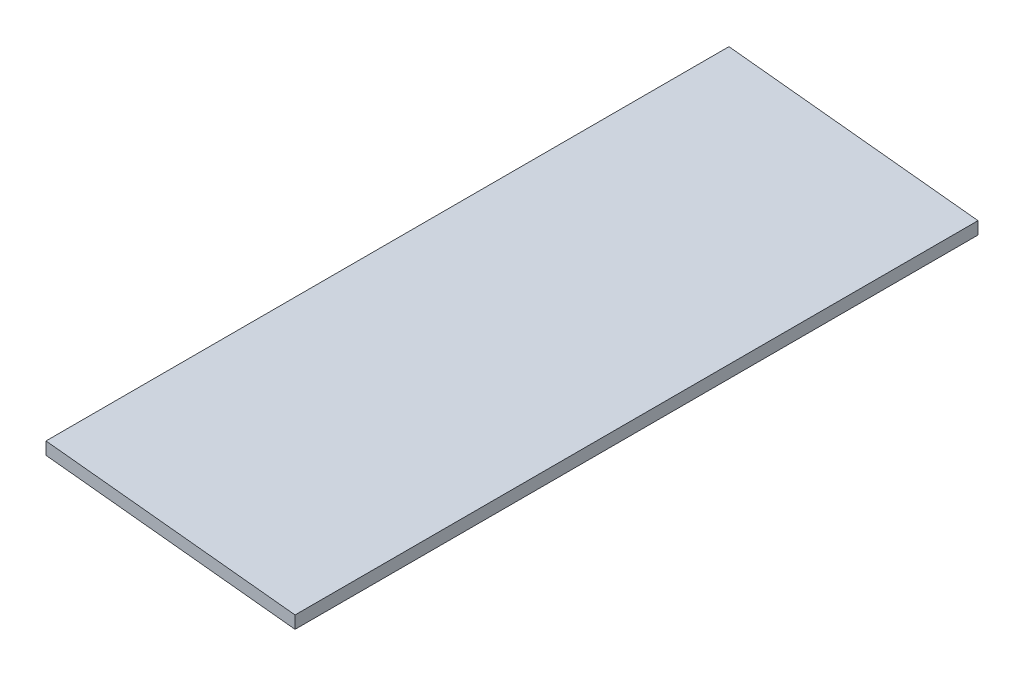
from build123d import *

# Parameters (mm, degrees)
BOSS_EXTRUDE2_DEPTH = 165


with BuildPart() as part:
    # Sketch2 → Boss-Extrude2 (new, symmetric)
    with BuildSketch(Plane.XY):
        Polygon((0, 0), (0, 6.033049677), (120.33714934, -6.614894378), (120.33714934, -12.647944055), align=None)
    extrude(amount=BOSS_EXTRUDE2_DEPTH, both=True)


solid = part.part
